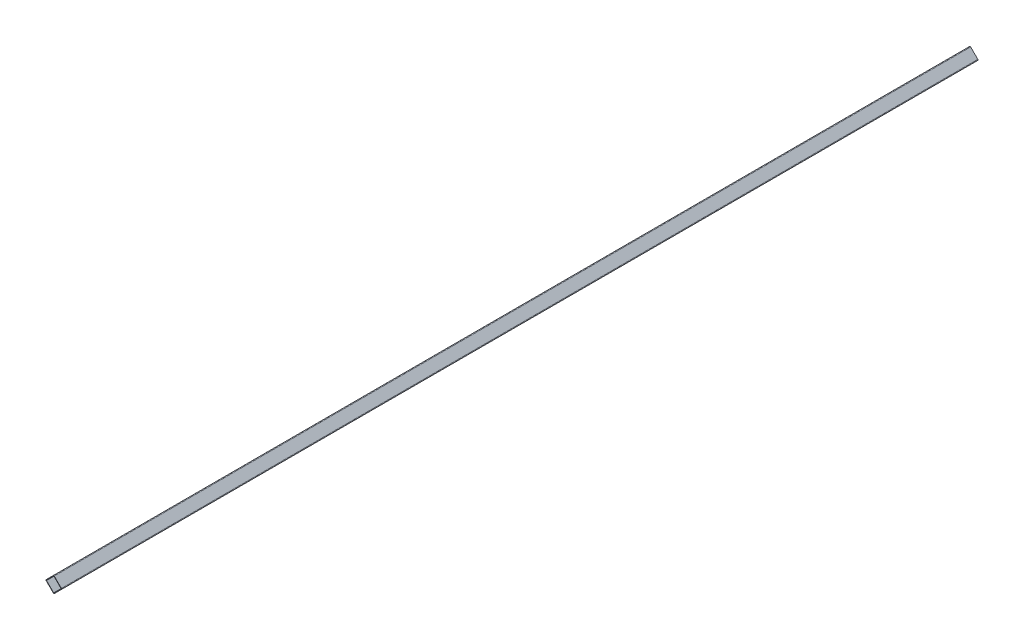
from build123d import *

# Parameters (mm, degrees)
BOSS_EXTRUDE1_DEPTH = 3048


with BuildPart() as part:
    # inch square tube → Boss-Extrude1 (new body)
    with BuildSketch(Plane.XY):
        with BuildLine():
            Line((25.243712088, -1.697056275), (1.697056275, -25.243712088))
            ThreePointArc((1.697056275, -25.243712088), (0, -25.946655814), (-1.697056275, -25.243712088))
            Line((-1.697056275, -25.243712088), (-25.243712088, -1.697056275))
            ThreePointArc((-25.243712088, -1.697056275), (-25.946655814, 0), (-25.243712088, 1.697056275))
            Line((-25.243712088, 1.697056275), (-1.697056275, 25.243712088))
            ThreePointArc((-1.697056275, 25.243712088), (0, 25.946655814), (1.697056275, 25.243712088))
            Line((1.697056275, 25.243712088), (25.243712088, 1.697056275))
            ThreePointArc((25.243712088, 1.697056275), (25.946655814, 0), (25.243712088, -1.697056275))
        make_face()
        with BuildLine():
            Line((-24.112341238, 0.565685425), (-0.565685425, 24.112341238))
            ThreePointArc((-0.565685425, 24.112341238), (0, 24.346655814), (0.565685425, 24.112341238))
            Line((0.565685425, 24.112341238), (24.112341238, 0.565685425))
            ThreePointArc((24.112341238, 0.565685425), (24.346655814, 0), (24.112341238, -0.565685425))
            Line((24.112341238, -0.565685425), (0.565685425, -24.112341238))
            ThreePointArc((0.565685425, -24.112341238), (0, -24.346655814), (-0.565685425, -24.112341238))
            Line((-0.565685425, -24.112341238), (-24.112341238, -0.565685425))
            ThreePointArc((-24.112341238, -0.565685425), (-24.346655814, 0), (-24.112341238, 0.565685425))
        make_face(mode=Mode.SUBTRACT)
    extrude(amount=BOSS_EXTRUDE1_DEPTH)


solid = part.part
